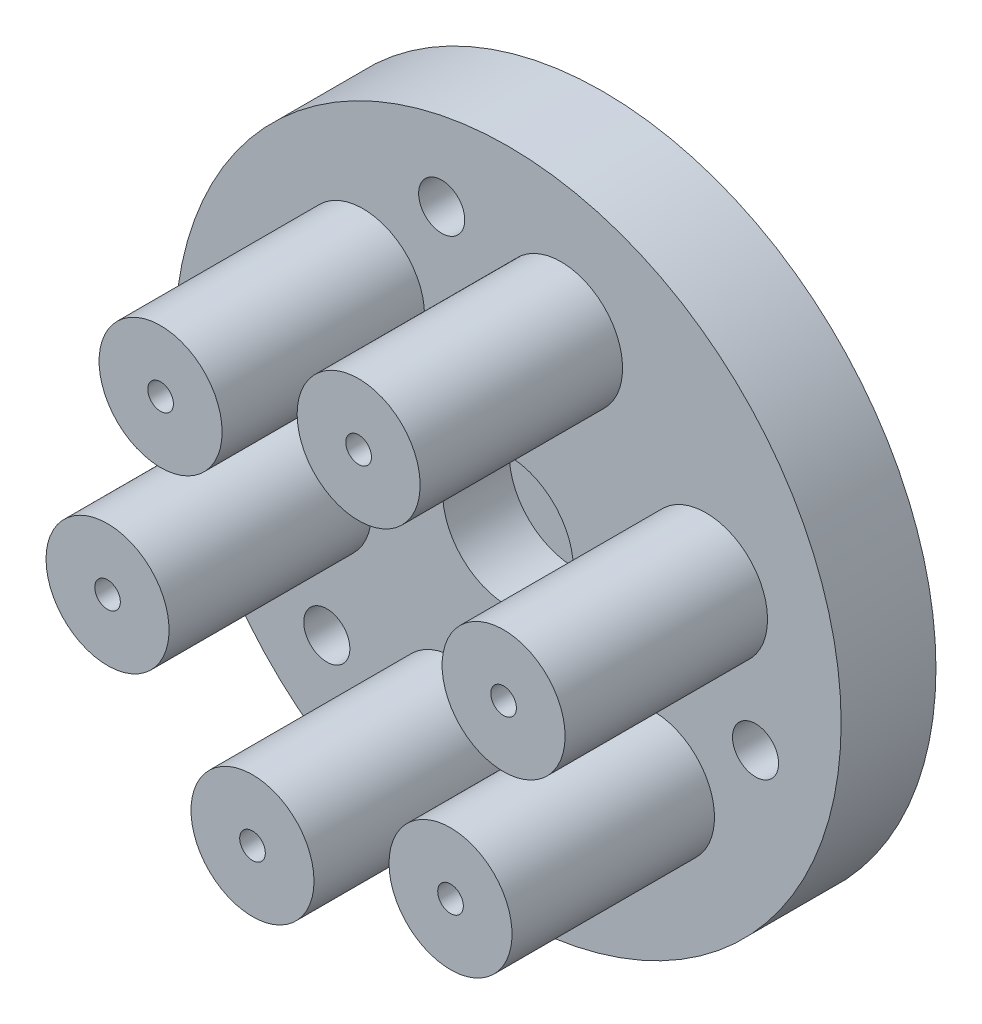
from build123d import *

# Parameters (mm, degrees)
SKETCH_1_R               = 13
EXTRUDE_1_DEPTH          = 3.7
SKETCH_3_R               = 2.4
SKETCH_3_R_2             = 0.5
EXTRUDE_3_DEPTH          = 7.9
PATTERN_CIRCULAR_1_COUNT = 6
SKETCH_4_R               = 0.9
CUT_EXTRUDE_1_DEPTH      = 21.010247375
PATTERN_CIRCULAR_2_COUNT = 3
SKETCH_5_R               = 1.1
CUT_EXTRUDE_2_DEPTH      = 21.010247375
SKETCH_5_4_R             = 2.55
SKETCH_5_4_R_2           = 1.1
CUT_EXTRUDE_3_DEPTH      = 2.6


with BuildPart() as part:
    # 草图1 → 凸台-拉伸1 (new body)
    with BuildSketch(Plane.XY):
        Circle(SKETCH_1_R)
    extrude(amount=EXTRUDE_1_DEPTH)

    # 草图3 → 凸台-拉伸3 (add)
    with BuildSketch(Plane.XY.offset(3.7)):
        with Locations((-5.656854249, 5.656854249)):
            Circle(SKETCH_3_R)
        with Locations((-5.656854249, 5.656854249)):
            Circle(SKETCH_3_R_2, mode=Mode.SUBTRACT)
    extrude_3 = extrude(amount=EXTRUDE_3_DEPTH)

    # 阵列(圆周)1: 凸台-拉伸3 ×6 about axis
    pattern_circular_1_axis = Axis((0, 0, 3.7), (0, 0, -1))
    for i in range(1, PATTERN_CIRCULAR_1_COUNT):
        add(extrude_3.rotate(pattern_circular_1_axis, i * 360 / PATTERN_CIRCULAR_1_COUNT))

    # 草图4 → 切除-拉伸1 (cut, through all)
    with BuildSketch(Plane.XY.offset(3.7)):
        with Locations((-2.588190451, 9.659258263)):
            Circle(SKETCH_4_R)
    cut_extrude_1 = extrude(amount=-CUT_EXTRUDE_1_DEPTH, mode=Mode.SUBTRACT)

    # 阵列(圆周)2: 切除-拉伸1 ×3 about axis
    pattern_circular_2_axis = Axis((0, 0, 3.7), (0, 0, -1))
    for i in range(1, PATTERN_CIRCULAR_2_COUNT):
        add(cut_extrude_1.rotate(pattern_circular_2_axis, i * 360 / PATTERN_CIRCULAR_2_COUNT), mode=Mode.SUBTRACT)

    # 草图5 → 切除-拉伸2 (cut, through all)
    with BuildSketch(Plane.XY.offset(3.7)):
        Circle(SKETCH_5_R)
    extrude(amount=-CUT_EXTRUDE_2_DEPTH, mode=Mode.SUBTRACT)

    # 草图5<4> → 切除-拉伸3 (cut)
    with BuildSketch(Plane.XY.offset(3.7)):
        Circle(SKETCH_5_4_R)
        Circle(SKETCH_5_4_R_2, mode=Mode.SUBTRACT)
    extrude(amount=-CUT_EXTRUDE_3_DEPTH, mode=Mode.SUBTRACT)


solid = part.part
